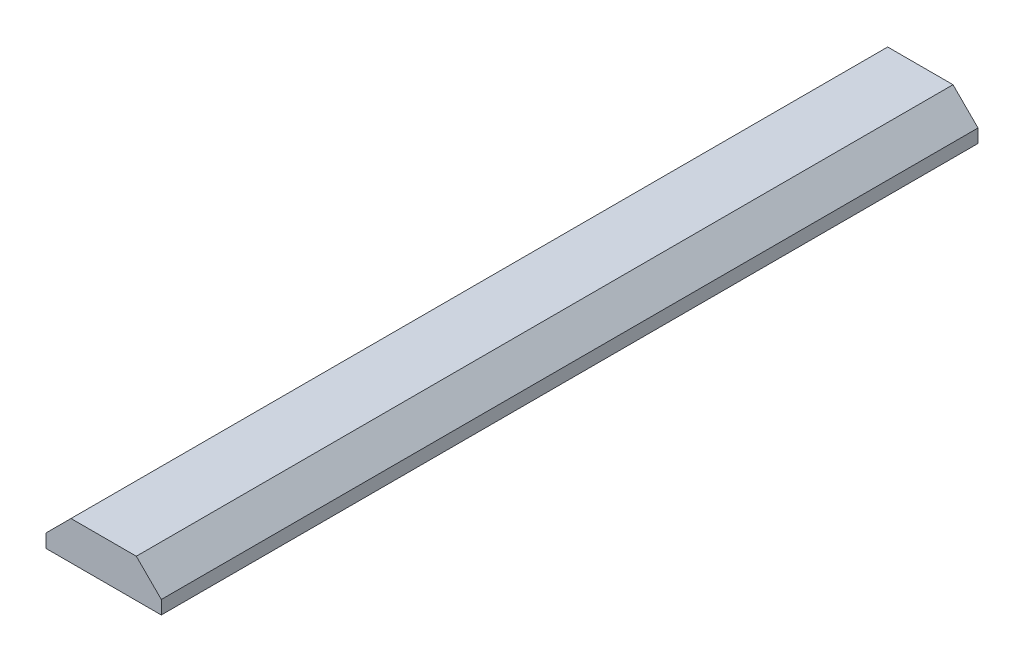
from build123d import *

# Parameters (mm, degrees)
AUFSATZ_LINEAR_AUSTRAGEN1_DEPTH = 85


with BuildPart() as part:
    # Skizze1 → Aufsatz-Linear austragen1 (new body)
    with BuildSketch(Plane.XY):
        Polygon((3.4, 1.808858787), (-3.4, 1.808858787), (-6, -0.791141213), (-6, -2.191141213), (6, -2.191141213), (6, -0.791141213), align=None)
    extrude(amount=AUFSATZ_LINEAR_AUSTRAGEN1_DEPTH)


solid = part.part
